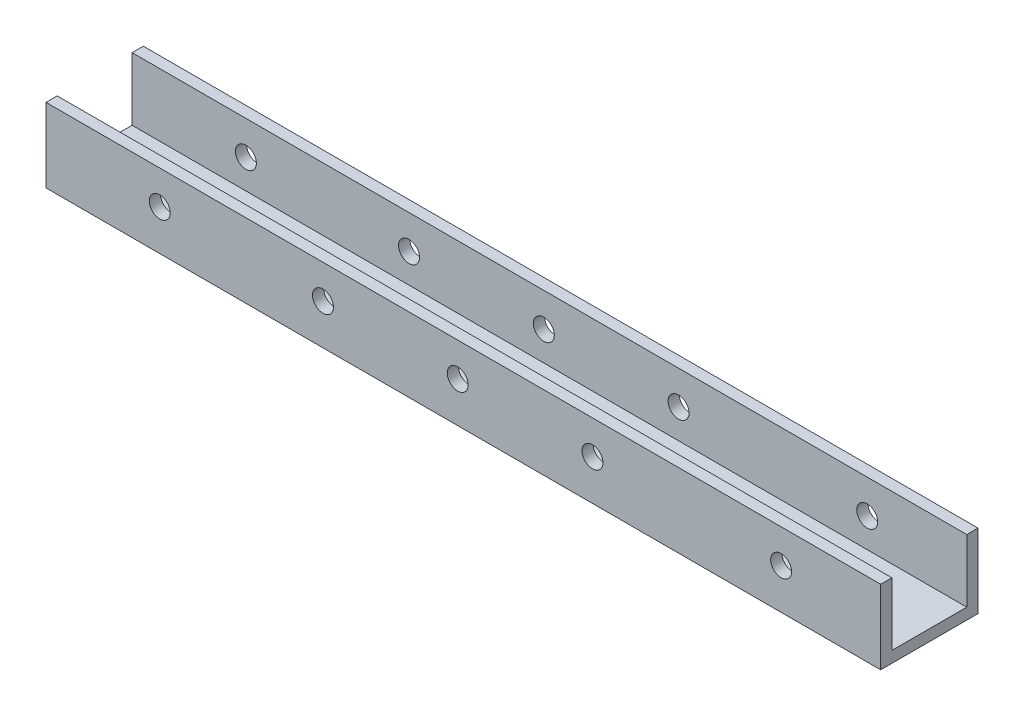
from build123d import *

# Parameters (mm, degrees)
ESQUISSE1_W             = 111.5
ESQUISSE1_H             = 13
BOSS_EXTRU_1_DEPTH      = 1.5
ESQUISSE2_W             = 111.5
ESQUISSE2_H             = 1.5
BOSS_EXTRU_2_DEPTH      = 8.4
ESQUISSE4_R             = 1.4
ENL_V_MAT_EXTRU_1_DEPTH = 20


with BuildPart() as part:
    # Esquisse1 → Boss.-Extru.1 (new body)
    with BuildSketch(Plane(origin=(0, 0, 0), x_dir=(1, 0, 0), z_dir=(0, 1, 0))):
        with Locations((55.75, 6.5)):
            Rectangle(ESQUISSE1_W, ESQUISSE1_H)
    extrude(amount=BOSS_EXTRU_1_DEPTH)

    # Esquisse2 → Boss.-Extru.2 (add)
    with BuildSketch(Plane(origin=(0, 1.5, 0), x_dir=(1, 0, 0), z_dir=(0, 1, 0))):
        with Locations((55.75, 12.25)):
            Rectangle(ESQUISSE2_W, ESQUISSE2_H)
        with Locations((55.75, 0.75)):
            Rectangle(ESQUISSE2_W, ESQUISSE2_H)
    extrude(amount=BOSS_EXTRU_2_DEPTH)

    # Esquisse4 → Enlèv. mat.-Extru.1 (cut)
    with BuildSketch(Plane.XY):
        with Locations((37, 5.4)):
            Circle(ESQUISSE4_R)
        with Locations((55, 5.4)):
            Circle(ESQUISSE4_R)
        with Locations((73, 5.4)):
            Circle(ESQUISSE4_R)
        with Locations((15.200278481, 5.4)):
            Circle(ESQUISSE4_R)
        with Locations((98.200278481, 5.4)):
            Circle(ESQUISSE4_R)
    extrude(amount=-ENL_V_MAT_EXTRU_1_DEPTH, mode=Mode.SUBTRACT)


solid = part.part
